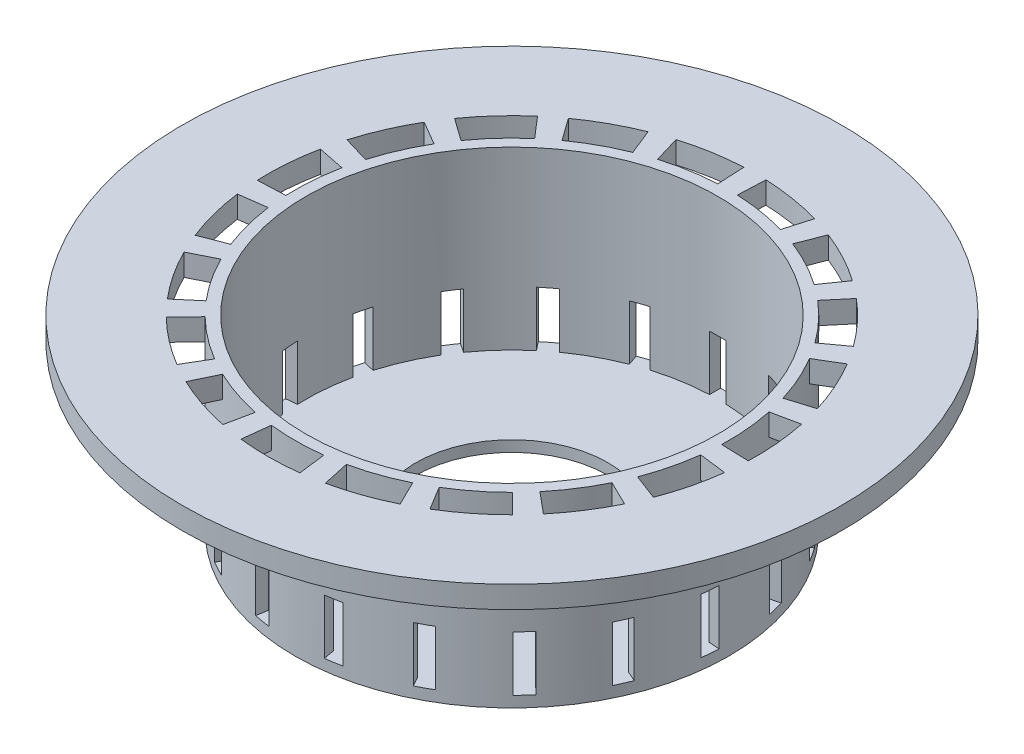
from build123d import *

# Parameters (mm, degrees)
SKETCH1_R           = 19.75
SKETCH1_R_2         = 18.75
BOSS_EXTRUDE1_DEPTH = 16
CUT_EXTRUDE1_DEPTH  = 5
CIRPATTERN1_COUNT   = 19
BOSS_EXTRUDE2_START = -2
BOSS_EXTRUDE2_DEPTH = 2
CIRPATTERN2_COUNT   = 19
BOSS_EXTRUDE3_START = 1
SKETCH5_R           = 19.75
SKETCH5_R_2         = 8.75
BOSS_EXTRUDE3_DEPTH = 1
BOSS_EXTRUDE4_START = -2
SKETCH6_R           = 30
SKETCH6_R_2         = 22.25
BOSS_EXTRUDE4_DEPTH = 2


with BuildPart() as part:
    # Sketch1 → Boss-Extrude1 (new body)
    with BuildSketch(Plane(origin=(0, 0, 0), x_dir=(1, 0, 0), z_dir=(0, 1, 0))):
        with Locations(Location((0, 0, 0), (0, 0, 270))):
            Circle(SKETCH1_R)
        with Locations(Location((0, 0, 0), (0, 0, 270))):
            Circle(SKETCH1_R_2, mode=Mode.SUBTRACT)
    extrude(amount=BOSS_EXTRUDE1_DEPTH)

    # Sketch2 → Cut-Extrude1 (cut)
    with BuildSketch(Plane(origin=(0, 0, 0), x_dir=(1, 0, 0), z_dir=(0, 1, 0))):
        with BuildLine():
            ThreePointArc((-0.749800016, 19.735761955), (0, 19.75), (0.749800016, 19.735761955))
            Line((0.749800016, 19.735761955), (0.749800016, 18.735002))
            ThreePointArc((0.749800016, 18.735002), (0, 18.75), (-0.749800016, 18.735002))
            Line((-0.749800016, 18.735002), (-0.749800016, 19.735761955))
        make_face()
    cut_extrude1 = extrude(amount=CUT_EXTRUDE1_DEPTH, mode=Mode.SUBTRACT)

    # CirPattern1: Cut-Extrude1 ×19 about axis
    cirpattern1_axis = Axis((0, 0, 0), (0, 1, 0))
    for i in range(1, CIRPATTERN1_COUNT):
        add(cut_extrude1.rotate(cirpattern1_axis, i * 360 / CIRPATTERN1_COUNT), mode=Mode.SUBTRACT)

    # Sketch4 → Boss-Extrude2 (add)
    with BuildSketch(Plane(origin=(0, 16, 0), x_dir=(1, 0, 0), z_dir=(0, 1, 0)).offset(BOSS_EXTRUDE2_START)):
        with BuildLine():
            Line((0.889762686, 22.232202373), (0.749800016, 18.735002))
            ThreePointArc((0.749800016, 18.735002), (-0.092696252, 18.749770863), (-0.935005309, 18.726672557))
            Line((-0.935005309, 18.726672557), (-1.109539634, 22.222318101))
            ThreePointArc((-1.109539634, 22.222318101), (-0.109999552, 22.24972809), (0.889762686, 22.232202373))
        make_face()
    boss_extrude2 = extrude(amount=BOSS_EXTRUDE2_DEPTH)

    # CirPattern2: Boss-Extrude2 ×19 about axis
    cirpattern2_axis = Axis((0, 0, 0), (0, 1, 0))
    for i in range(1, CIRPATTERN2_COUNT):
        add(boss_extrude2.rotate(cirpattern2_axis, i * 360 / CIRPATTERN2_COUNT))

    # Sketch5 → Boss-Extrude3 (add)
    with BuildSketch(Plane.XZ.offset(BOSS_EXTRUDE3_START)):
        with Locations(Location((0, 0, 0), (0, 0, 270))):
            Circle(SKETCH5_R)
        with Locations(Location((0, 0, 0), (0, 0, 270))):
            Circle(SKETCH5_R_2, mode=Mode.SUBTRACT)
    extrude(amount=-BOSS_EXTRUDE3_DEPTH)

    # Sketch6 → Boss-Extrude4 (add)
    with BuildSketch(Plane(origin=(0, 16, 0), x_dir=(1, 0, 0), z_dir=(0, 1, 0)).offset(BOSS_EXTRUDE4_START)):
        with Locations(Location((0, 0, 0), (0, 0, 270))):
            Circle(SKETCH6_R)
        Circle(SKETCH6_R_2, mode=Mode.SUBTRACT)
    extrude(amount=BOSS_EXTRUDE4_DEPTH)


solid = part.part
